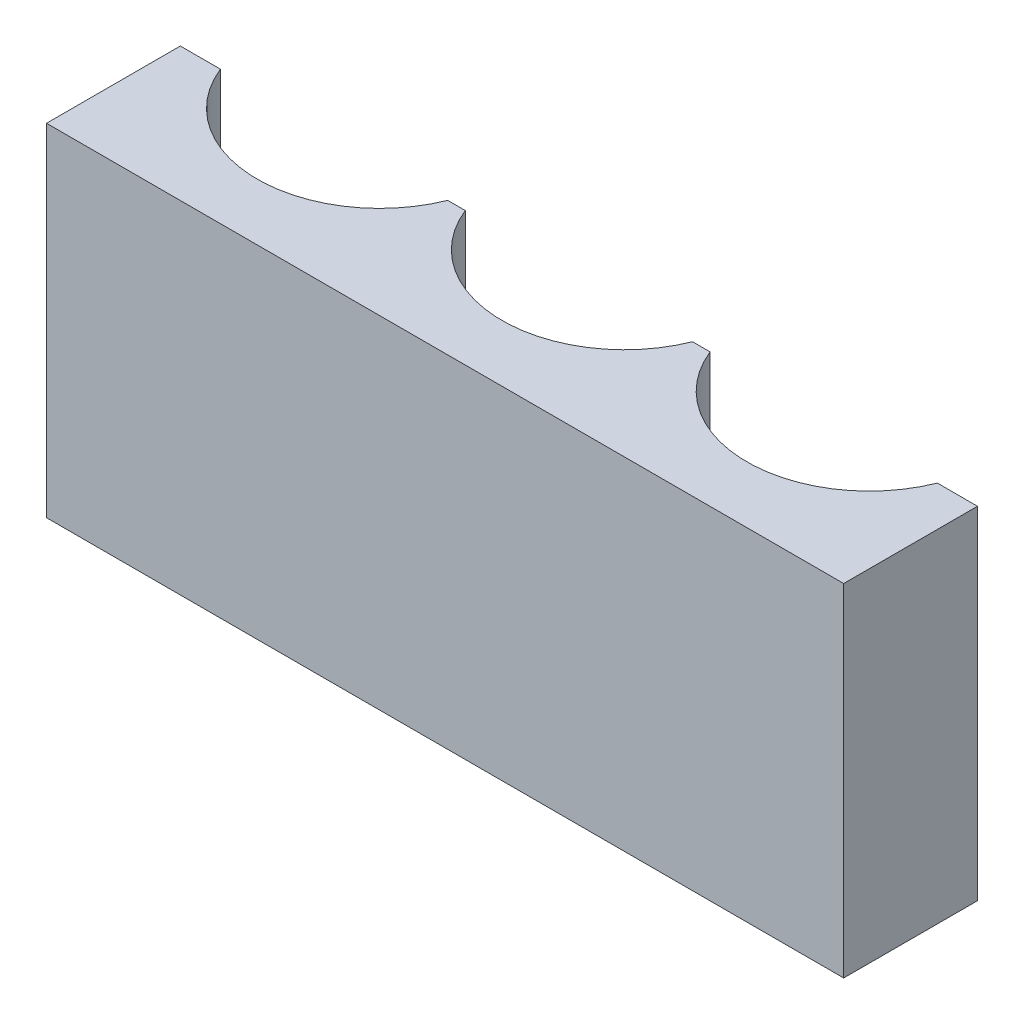
from build123d import *

# Parameters (mm, degrees)
SKETCH_1_W          = 70
SKETCH_1_H          = 30
EXTRUDE_1_DEPTH     = 15.75
CUT_EXTRUDE_1_DEPTH = 30
SKETCH_4_W          = 70
SKETCH_4_H          = 4
CUT_EXTRUDE_2_DEPTH = 30
SKETCH_6_W          = 5
SKETCH_6_H          = 10
CUT_EXTRUDE_3_DEPTH = 10


with BuildPart() as part:
    # 草图1 → 凸台-拉伸1 (new body)
    with BuildSketch(Plane.XY):
        Rectangle(SKETCH_1_W, SKETCH_1_H)
    extrude(amount=EXTRUDE_1_DEPTH)

    # 草图3 → 切除-拉伸1 (cut)
    with BuildSketch(Plane(origin=(0, 15, 0), x_dir=(1, 0, 0), z_dir=(0, 1, 0))):
        with BuildLine():
            ThreePointArc((-32.25, 0), (-21.5, -10.75), (-10.75, 0))
            Line((-10.75, 0), (-32.25, 0))
        make_face()
        with BuildLine():
            Line((10.75, 0), (-10.75, 0))
            ThreePointArc((-10.75, 0), (0, -10.75), (10.75, 0))
        make_face()
        with BuildLine():
            Line((32.25, 0), (10.75, 0))
            ThreePointArc((10.75, 0), (21.5, -10.75), (32.25, 0))
        make_face()
    extrude(amount=-CUT_EXTRUDE_1_DEPTH, mode=Mode.SUBTRACT)

    # 草图4 → 切除-拉伸2 (cut)
    with BuildSketch(Plane(origin=(0, 15, 0), x_dir=(1, 0, 0), z_dir=(0, 1, 0))):
        with Locations((0, -2)):
            Rectangle(SKETCH_4_W, SKETCH_4_H)
    extrude(amount=-CUT_EXTRUDE_2_DEPTH, mode=Mode.SUBTRACT)

    # 草图6 → 切除-拉伸3 (cut)
    with BuildSketch(Plane(origin=(0, 0, 4), x_dir=(-1, 0, 0), z_dir=(0, 0, -1))):
        with Locations((21.5, 0)):
            Rectangle(SKETCH_6_W, SKETCH_6_H)
        Rectangle(SKETCH_6_W, SKETCH_6_H)
        with Locations((-21.5, 0)):
            Rectangle(SKETCH_6_W, SKETCH_6_H)
    extrude(amount=-CUT_EXTRUDE_3_DEPTH, mode=Mode.SUBTRACT)


solid = part.part
